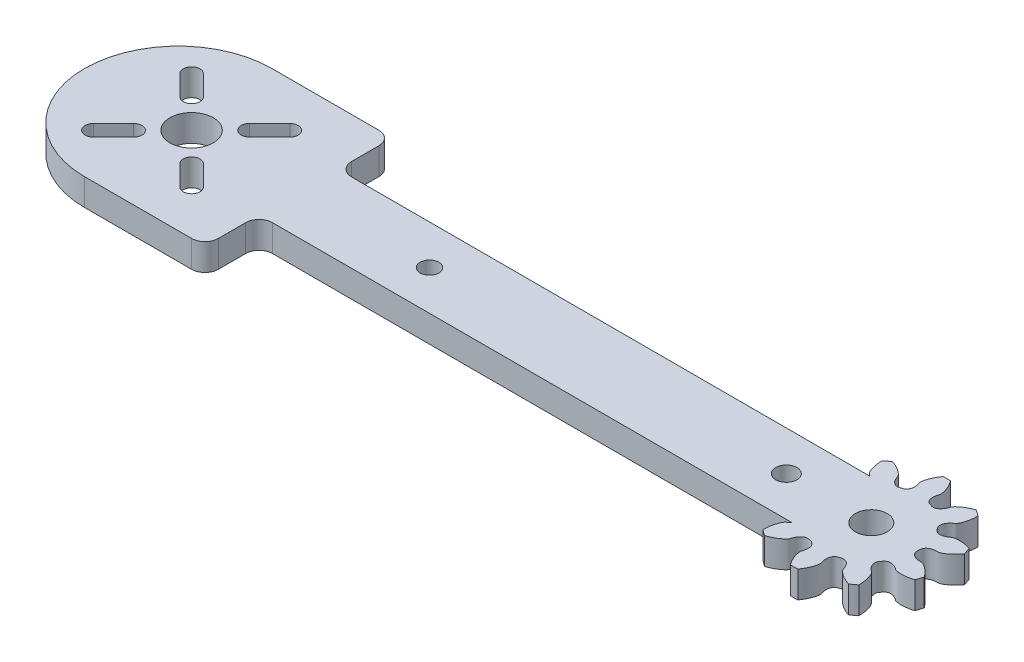
from build123d import *

# Parameters (mm, degrees)
SKETCH1_R           = 3.25
SKETCH1_R_2         = 2.38125
SKETCH1_R_3         = 1.397
BOSS_EXTRUDE1_DEPTH = 4
SKETCH2_R           = 1.5875
CUT_EXTRUDE1_DEPTH  = 10
SKETCH3_R           = 4.073496064
BOSS_EXTRUDE2_DEPTH = 4


with BuildPart() as part:
    # Sketch1 → Boss-Extrude1 (new body)
    with BuildSketch(Plane(origin=(0, 0, 0), x_dir=(1, 0, 0), z_dir=(0, 1, 0))):
        with BuildLine():
            Line((-50.8, 14), (-36.8, 14))
            ThreePointArc((-36.8, 14), (-35.385786438, 13.414213562), (-34.8, 12))
            Line((-34.8, 12), (-34.8, 7.914556152))
            ThreePointArc((-34.8, 7.914556152), (-34.214213562, 6.500342589), (-32.8, 5.914556152))
            Line((-32.8, 5.914556152), (50.8, 5.914556152))
            ThreePointArc((50.8, 5.914556152), (56.714556152, 0), (50.8, -5.914556152))
            Line((50.8, -5.914556152), (-32.8, -5.914556152))
            ThreePointArc((-32.8, -5.914556152), (-34.214213562, -6.500342589), (-34.8, -7.914556152))
            Line((-34.8, -7.914556152), (-34.8, -12))
            ThreePointArc((-34.8, -12), (-35.385786438, -13.414213562), (-36.8, -14))
            Line((-36.8, -14), (-50.8, -14))
            Line((-50.8, -14), (-52.8, -14))
            ThreePointArc((-52.8, -14), (-66.8, 0), (-52.8, 14))
            Line((-52.8, 14), (-50.8, 14))
        make_face()
        with Locations(Location((-50.8, 0, 0), (0, 0, 270))):
            Circle(SKETCH1_R, mode=Mode.SUBTRACT)
        with Locations(Location((50.8, 0, 0), (0, 0, 270))):
            Circle(SKETCH1_R_2, mode=Mode.SUBTRACT)
        with Locations(Location((-15.24, 0, 0), (0, 0, 270))):
            Circle(SKETCH1_R_3, mode=Mode.SUBTRACT)
        with BuildLine():
            Line((-57.252349378, 8.220116331), (-54.247145558, 5.214912511))
            ThreePointArc((-54.247145558, 5.214912511), (-54.247145558, 3.447145558), (-56.014912511, 3.447145558))
            Line((-56.014912511, 3.447145558), (-59.020116331, 6.452349378))
            ThreePointArc((-59.020116331, 6.452349378), (-59.020116331, 8.220116331), (-57.252349378, 8.220116331))
        make_face(mode=Mode.SUBTRACT)
        with BuildLine():
            Line((-42.579883669, 6.452349378), (-45.585087489, 3.447145558))
            ThreePointArc((-45.585087489, 3.447145558), (-47.352854442, 3.447145558), (-47.352854442, 5.214912511))
            Line((-47.352854442, 5.214912511), (-44.347650622, 8.220116331))
            ThreePointArc((-44.347650622, 8.220116331), (-42.579883669, 8.220116331), (-42.579883669, 6.452349378))
        make_face(mode=Mode.SUBTRACT)
        with BuildLine():
            Line((-44.347650622, -8.220116331), (-47.352854442, -5.214912511))
            ThreePointArc((-47.352854442, -5.214912511), (-47.352854442, -3.447145558), (-45.585087489, -3.447145558))
            Line((-45.585087489, -3.447145558), (-42.579883669, -6.452349378))
            ThreePointArc((-42.579883669, -6.452349378), (-42.579883669, -8.220116331), (-44.347650622, -8.220116331))
        make_face(mode=Mode.SUBTRACT)
        with BuildLine():
            Line((-59.020116331, -6.452349378), (-56.014912511, -3.447145558))
            ThreePointArc((-56.014912511, -3.447145558), (-54.247145558, -3.447145558), (-54.247145558, -5.214912511))
            Line((-54.247145558, -5.214912511), (-57.252349378, -8.220116331))
            ThreePointArc((-57.252349378, -8.220116331), (-59.020116331, -8.220116331), (-59.020116331, -6.452349378))
        make_face(mode=Mode.SUBTRACT)
    extrude(amount=BOSS_EXTRUDE1_DEPTH)

    # Sketch2 → Cut-Extrude1 (cut)
    with BuildSketch(Plane.XZ):
        with Locations(Location((38.1, 0, 0), (0, 0, 270))):
            Circle(SKETCH2_R)
    extrude(amount=-CUT_EXTRUDE1_DEPTH, mode=Mode.SUBTRACT)

    # Sketch3 → Boss-Extrude2 (add)
    with BuildSketch(Plane.XZ):
        with BuildLine():
            ThreePointArc((40.068598751, 4.133432129), (39.882647493, 3.605484733), (39.722765528, 3.069066911))
            add(Edge.make_bspline(
                [(39.722765528, 3.069066911), (39.809182967, 2.951634685), (39.952249972, 2.769228405), (40.158056435, 2.533738008), (40.325254018, 2.357387729), (40.488900389, 2.198223732), (40.6478942, 2.055651331), (40.801177141, 1.929015404), (40.947736968, 1.81760209), (41.086610747, 1.720645895), (41.216886482, 1.637317611), (41.337709478, 1.566775841), (41.448272804, 1.508014381), (41.547857445, 1.460356241), (41.635717662, 1.42194253), (41.728626895, 1.388001471), (41.848319719, 1.338065212), (41.966297751, 1.36311056), (42.057264692, 1.361140027), (42.105090723, 1.360437185), (42.152350457, 1.35867433), (42.199081225, 1.356226565), (42.29005034, 1.349871492), (42.408565167, 1.336535688), (42.552522967, 1.310710882), (42.676508835, 1.280779699), (42.795551967, 1.243895566), (42.909631527, 1.199785197), (43.018680002, 1.148016382), (43.110978775, 1.094644363), (43.187938568, 1.042176976), (43.251233813, 0.992889841), (43.311581446, 0.938972225), (43.368591345, 0.880099745), (43.421732251, 0.815974745), (43.470311441, 0.74637776), (43.513470144, 0.671236598), (43.550206445, 0.590708012), (43.579437165, 0.505258208), (43.596599863, 0.430906413), (43.605653125, 0.369875838), (43.610043077, 0.323392341), (43.611600505, 0.281813138), (43.611583378, 0.198459401), (43.607687576, 0.073420488), (43.611583378, -0.051618426), (43.611600505, -0.134972163), (43.610043077, -0.176551366), (43.605653125, -0.223034863), (43.596599863, -0.284065438), (43.579436317, -0.358417073), (43.550206682, -0.443867), (43.513470229, -0.524395611), (43.470311544, -0.599536804), (43.42173233, -0.669133808), (43.368591406, -0.733258818), (43.311581485, -0.792131303), (43.251233855, -0.846048909), (43.17746321, -0.903493053), (43.088504479, -0.962111014), (42.982897208, -1.019316936), (42.872159068, -1.068473874), (42.756420765, -1.110135864), (42.635728848, -1.144678819), (42.510097104, -1.17233085), (42.37953633, -1.193203414), (42.275273033, -1.204062855), (42.199081225, -1.20938559), (42.152350457, -1.211833355), (42.105090723, -1.21359621), (42.057264692, -1.214299052), (41.966297751, -1.216269585), (41.848319719, -1.191224237), (41.728626895, -1.241160496), (41.635717662, -1.275101555), (41.547857445, -1.313515265), (41.448272804, -1.361173405), (41.337709478, -1.419934865), (41.216886482, -1.490476636), (41.086610747, -1.57380492), (40.947736968, -1.670761115), (40.801177141, -1.782174428), (40.6478942, -1.908810356), (40.488900389, -2.051382757), (40.325254018, -2.210546754), (40.158056435, -2.386897033), (39.952249972, -2.62238743), (39.809182967, -2.80479371), (39.722765528, -2.922225936)],
                knots=[0.011285362, 0.011285362, 0.011285362, 0.011285362, 0.051699305, 0.075508195, 0.097956577, 0.119044452, 0.138771818, 0.157138677, 0.174145027, 0.18979087, 0.204076205, 0.217001032, 0.22856535, 0.238769161, 0.247612465, 0.25509526, 0.266315064, 0.282698066, 0.287163522, 0.29158073, 0.295950533, 0.300273826, 0.304551554, 0.321227804, 0.333312172, 0.345076541, 0.356567223, 0.367839534, 0.378959166, 0.390003215, 0.397367218, 0.404765512, 0.412228116, 0.41978525, 0.427465674, 0.435294369, 0.443289607, 0.451459663, 0.45979972, 0.468289823, 0.472580702, 0.476894834, 0.48122589, 0.484108929, 0.5, 0.515891071, 0.51877411, 0.523105166, 0.527419298, 0.531710177, 0.54020028, 0.548540337, 0.556710393, 0.564705631, 0.572534326, 0.58021475, 0.587771884, 0.595234488, 0.602632782, 0.613674977, 0.624734931, 0.635897467, 0.647235808, 0.658812047, 0.67067834, 0.682878315, 0.695448446, 0.699726174, 0.704049467, 0.70841927, 0.712836478, 0.717301934, 0.733684936, 0.74490474, 0.752387535, 0.761230839, 0.77143465, 0.782998968, 0.795923795, 0.81020913, 0.825854973, 0.842861323, 0.861228182, 0.880955548, 0.902043423, 0.924491805, 0.948300695, 0.988714638, 0.988714638, 0.988714638, 0.988714638], degree=3, weights=[1, 1, 1, 1, 1, 1, 1, 1, 1, 1, 1, 1, 1, 1, 1, 1, 1, 1, 1, 1, 1, 1, 1, 1, 1, 1, 1, 1, 1, 1, 1, 1, 1, 1, 1, 1, 1, 1, 1, 1, 1, 1, 1, 1, 1, 1, 1, 1, 1, 1, 1, 1, 1, 1, 1, 1, 1, 1, 1, 1, 1, 1, 1, 1, 1, 1, 1, 1, 1, 1, 1, 1, 1, 1, 1, 1, 1, 1, 1, 1, 1, 1, 1, 1, 1, 1, 1, 1, 1]))
            ThreePointArc((39.722765528, -2.922225936), (39.882647493, -3.458643758), (40.068598751, -3.986591153))
            add(Edge.make_bspline(
                [(40.068598751, -3.986591153), (40.207536858, -4.030800924), (40.430496218, -4.094278029), (40.735414927, -4.163823758), (40.974336706, -4.208217857), (41.200283652, -4.240795312), (41.412714301, -4.26268459), (41.611157536, -4.275037755), (41.795214029, -4.279027315), (41.964554698, -4.275838565), (42.118929118, -4.266678407), (42.258140387, -4.252729923), (42.382127117, -4.23528145), (42.490705535, -4.215303312), (42.584364956, -4.194737717), (42.679480159, -4.167585934), (42.805665485, -4.137631538), (42.886390431, -4.048023679), (42.961142482, -3.996148847), (43.000247674, -3.968606023), (43.039517783, -3.942253628), (43.078762529, -3.916766255), (43.156093506, -3.868437313), (43.259812604, -3.809564938), (43.391456351, -3.745841373), (43.509356134, -3.697179144), (43.627344, -3.657047237), (43.745563727, -3.625678992), (43.864214743, -3.603463758), (43.970257304, -3.592390771), (44.063358641, -3.589601947), (44.143535821, -3.592272065), (44.224050061, -3.600420884), (44.304776413, -3.614540143), (44.385460039, -3.635182917), (44.46566951, -3.662933929), (44.544752501, -3.698356357), (44.621806309, -3.741912296), (44.695680593, -3.793861253), (44.753268395, -3.843925138), (44.79646551, -3.887978537), (44.82733937, -3.923004127), (44.853038998, -3.955726976), (44.90201924, -4.023171632), (44.972363499, -4.126620133), (45.049011298, -4.225488844), (45.098019251, -4.292913367), (45.121198907, -4.327467082), (45.144969676, -4.36765337), (45.173518305, -4.422349516), (45.203335499, -4.492589731), (45.229914435, -4.578900923), (45.247527549, -4.665643083), (45.256778326, -4.751801624), (45.258385008, -4.836660928), (45.253084833, -4.919774603), (45.241567217, -5.000913035), (45.224436932, -5.080004741), (45.198520047, -5.169839327), (45.161005694, -5.269550884), (45.109192415, -5.377905843), (45.048497101, -5.482764887), (44.979351151, -5.584499412), (44.902013178, -5.683386179), (44.816628418, -5.779601629), (44.723271119, -5.873229585), (44.645303359, -5.943299485), (44.586791516, -5.992390089), (44.550424291, -6.021838029), (44.513226543, -6.051042784), (44.474947592, -6.079722831), (44.402512041, -6.134786052), (44.292344522, -6.183869687), (44.224862789, -6.294622646), (44.169647695, -6.376692217), (44.121146298, -6.459412501), (44.068593384, -6.556503129), (44.013684893, -6.669029641), (43.957400449, -6.797117108), (43.900984302, -6.941105261), (43.845622476, -7.10117243), (43.792540188, -7.277453399), (43.742966414, -7.470001468), (43.698139674, -7.678799181), (43.659301228, -7.903754483), (43.627691636, -8.144701129), (43.599608491, -8.456186866), (43.591080575, -8.687849323), (43.590192329, -8.833648885)],
                knots=[0.011285362, 0.011285362, 0.011285362, 0.011285362, 0.051699305, 0.075508195, 0.097956577, 0.119044452, 0.138771818, 0.157138677, 0.174145027, 0.18979087, 0.204076205, 0.217001032, 0.22856535, 0.238769161, 0.247612465, 0.25509526, 0.266315064, 0.282698066, 0.287163522, 0.29158073, 0.295950533, 0.300273826, 0.304551554, 0.321227804, 0.333312172, 0.345076541, 0.356567223, 0.367839534, 0.378959166, 0.390003215, 0.397367218, 0.404765512, 0.412228116, 0.41978525, 0.427465674, 0.435294369, 0.443289607, 0.451459663, 0.45979972, 0.468289823, 0.472580702, 0.476894834, 0.48122589, 0.484108929, 0.5, 0.515891071, 0.51877411, 0.523105166, 0.527419298, 0.531710177, 0.54020028, 0.548540337, 0.556710393, 0.564705631, 0.572534326, 0.58021475, 0.587771884, 0.595234488, 0.602632782, 0.613674977, 0.624734931, 0.635897467, 0.647235808, 0.658812047, 0.67067834, 0.682878315, 0.695448446, 0.699726174, 0.704049467, 0.70841927, 0.712836478, 0.717301934, 0.733684936, 0.74490474, 0.752387535, 0.761230839, 0.77143465, 0.782998968, 0.795923795, 0.81020913, 0.825854973, 0.842861323, 0.861228182, 0.880955548, 0.902043423, 0.924491805, 0.948300695, 0.988714638, 0.988714638, 0.988714638, 0.988714638], degree=3, weights=[1, 1, 1, 1, 1, 1, 1, 1, 1, 1, 1, 1, 1, 1, 1, 1, 1, 1, 1, 1, 1, 1, 1, 1, 1, 1, 1, 1, 1, 1, 1, 1, 1, 1, 1, 1, 1, 1, 1, 1, 1, 1, 1, 1, 1, 1, 1, 1, 1, 1, 1, 1, 1, 1, 1, 1, 1, 1, 1, 1, 1, 1, 1, 1, 1, 1, 1, 1, 1, 1, 1, 1, 1, 1, 1, 1, 1, 1, 1, 1, 1, 1, 1, 1, 1, 1, 1, 1, 1]))
            ThreePointArc((43.590192329, -8.833648885), (44.03483804, -9.173643758), (44.495595461, -9.491462766))
            add(Edge.make_bspline(
                [(44.495595461, -9.491462766), (44.633984602, -9.445563451), (44.85167342, -9.365865284), (45.139235791, -9.24290224), (45.358621767, -9.138383123), (45.560565233, -9.031930555), (45.745291434, -8.92477575), (45.913096392, -8.818127664), (46.064346227, -8.713169593), (46.199471406, -8.611053892), (46.318978729, -8.512904162), (46.423404299, -8.41979327), (46.513455715, -8.332799588), (46.589554646, -8.252816142), (46.653238555, -8.181126599), (46.714228953, -8.103253032), (46.798708274, -8.004849544), (46.81134595, -7.884906329), (46.841330368, -7.799000556), (46.856777867, -7.753732487), (46.873058503, -7.709330561), (46.889827068, -7.665643361), (46.923982103, -7.581090417), (46.973288303, -7.472497109), (47.042334559, -7.343565409), (47.109114547, -7.234897086), (47.180979792, -7.133078163), (47.258183769, -7.038212908), (47.34111667, -6.950499088), (47.420398365, -6.8792106), (47.4940797, -6.822230802), (47.560513857, -6.777264009), (47.630441001, -6.736531459), (47.704049084, -6.70050442), (47.781457027, -6.66978013), (47.862659488, -6.645085226), (47.947459752, -6.627258756), (48.03539913, -6.617205159), (48.125699513, -6.615810534), (48.201715837, -6.622463806), (48.262556975, -6.632713128), (48.308121977, -6.642902226), (48.348147421, -6.654269704), (48.427416243, -6.680043713), (48.545131448, -6.72238799), (48.66525439, -6.757322012), (48.744533797, -6.783063445), (48.783596697, -6.797393327), (48.82644856, -6.81593261), (48.881694475, -6.843402259), (48.947103254, -6.882701679), (49.01933851, -6.936906194), (49.084573582, -6.996729347), (49.142700336, -7.0609956), (49.193879218, -7.128703836), (49.238444278, -7.199059575), (49.276818305, -7.27147183), (49.309448551, -7.345527294), (49.341284796, -7.433438564), (49.369544029, -7.536157291), (49.391315653, -7.654273376), (49.403846712, -7.774781935), (49.407704517, -7.897729865), (49.403260966, -8.023189059), (49.390737266, -8.151216896), (49.370242756, -8.281837547), (49.348351568, -8.384353587), (49.329869226, -8.458461118), (49.317756588, -8.50366112), (49.304829101, -8.549152551), (49.290718488, -8.594854999), (49.264482245, -8.681978629), (49.204205487, -8.786442967), (49.214710574, -8.915708761), (49.218279908, -9.014559056), (49.227663217, -9.109989577), (49.242215455, -9.219427374), (49.263934978, -9.342737635), (49.293687829, -9.479445739), (49.332680321, -9.629095181), (49.381976784, -9.791133106), (49.442647665, -9.964948392), (49.515718555, -10.149861785), (49.602181177, -10.34513118), (49.702985623, -10.549952508), (49.819037811, -10.763462091), (49.979404792, -11.031966204), (50.108673338, -11.224397652), (50.193653565, -11.342874074)],
                knots=[0.011285362, 0.011285362, 0.011285362, 0.011285362, 0.051699305, 0.075508195, 0.097956577, 0.119044452, 0.138771818, 0.157138677, 0.174145027, 0.18979087, 0.204076205, 0.217001032, 0.22856535, 0.238769161, 0.247612465, 0.25509526, 0.266315064, 0.282698066, 0.287163522, 0.29158073, 0.295950533, 0.300273826, 0.304551554, 0.321227804, 0.333312172, 0.345076541, 0.356567223, 0.367839534, 0.378959166, 0.390003215, 0.397367218, 0.404765512, 0.412228116, 0.41978525, 0.427465674, 0.435294369, 0.443289607, 0.451459663, 0.45979972, 0.468289823, 0.472580702, 0.476894834, 0.48122589, 0.484108929, 0.5, 0.515891071, 0.51877411, 0.523105166, 0.527419298, 0.531710177, 0.54020028, 0.548540337, 0.556710393, 0.564705631, 0.572534326, 0.58021475, 0.587771884, 0.595234488, 0.602632782, 0.613674977, 0.624734931, 0.635897467, 0.647235808, 0.658812047, 0.67067834, 0.682878315, 0.695448446, 0.699726174, 0.704049467, 0.70841927, 0.712836478, 0.717301934, 0.733684936, 0.74490474, 0.752387535, 0.761230839, 0.77143465, 0.782998968, 0.795923795, 0.81020913, 0.825854973, 0.842861323, 0.861228182, 0.880955548, 0.902043423, 0.924491805, 0.948300695, 0.988714638, 0.988714638, 0.988714638, 0.988714638], degree=3, weights=[1, 1, 1, 1, 1, 1, 1, 1, 1, 1, 1, 1, 1, 1, 1, 1, 1, 1, 1, 1, 1, 1, 1, 1, 1, 1, 1, 1, 1, 1, 1, 1, 1, 1, 1, 1, 1, 1, 1, 1, 1, 1, 1, 1, 1, 1, 1, 1, 1, 1, 1, 1, 1, 1, 1, 1, 1, 1, 1, 1, 1, 1, 1, 1, 1, 1, 1, 1, 1, 1, 1, 1, 1, 1, 1, 1, 1, 1, 1, 1, 1, 1, 1, 1, 1, 1, 1, 1, 1]))
            ThreePointArc((50.193653565, -11.342874074), (50.753223474, -11.356579512), (51.312793383, -11.342874074))
            add(Edge.make_bspline(
                [(51.312793383, -11.342874074), (51.39777361, -11.224397652), (51.527042156, -11.031966204), (51.687409137, -10.763462091), (51.803461325, -10.549952508), (51.904265771, -10.34513118), (51.990728393, -10.149861785), (52.063799283, -9.964948392), (52.124470164, -9.791133106), (52.173766627, -9.629095181), (52.212759119, -9.479445739), (52.24251197, -9.342737635), (52.264231493, -9.219427374), (52.278783731, -9.109989577), (52.28816704, -9.014559056), (52.291736374, -8.915708761), (52.302241461, -8.786442967), (52.241964703, -8.681978629), (52.21572846, -8.594854999), (52.201617847, -8.549152551), (52.18869036, -8.50366112), (52.176577722, -8.458461118), (52.154510753, -8.369980523), (52.130570761, -8.253145235), (52.110646204, -8.108252927), (52.100798711, -7.981086115), (52.099091255, -7.856471545), (52.105790186, -7.734344582), (52.121327423, -7.614635875), (52.14356534, -7.510361665), (52.169682906, -7.420955239), (52.19699845, -7.345527321), (52.229628707, -7.271471851), (52.268002734, -7.199059619), (52.312567791, -7.128703899), (52.363746662, -7.060995693), (52.42187338, -6.996729431), (52.487108476, -6.936906431), (52.559343279, -6.882700922), (52.624752473, -6.843402259), (52.679998388, -6.81593261), (52.722850251, -6.797393327), (52.761913151, -6.783063445), (52.841192558, -6.757322012), (52.9613155, -6.72238799), (53.079030704, -6.680043713), (53.158299527, -6.654269704), (53.198324971, -6.642902226), (53.243889973, -6.632713128), (53.304731111, -6.622463806), (53.380747545, -6.615811389), (53.471047709, -6.617204944), (53.558987158, -6.627258679), (53.643787446, -6.645085121), (53.724989933, -6.669780043), (53.802397891, -6.700504346), (53.876005986, -6.736531405), (53.945933119, -6.777263955), (54.02336213, -6.829672792), (54.106600883, -6.896163626), (54.193641389, -6.978924507), (54.274612383, -7.069052408), (54.350000392, -7.166251812), (54.420148548, -7.270362285), (54.485269537, -7.381300227), (54.545466022, -7.499020925), (54.588013095, -7.594825461), (54.61661988, -7.665643361), (54.633388445, -7.709330561), (54.649669081, -7.753732487), (54.66511658, -7.799000556), (54.695100998, -7.884906329), (54.707738674, -8.004849544), (54.792217995, -8.103253032), (54.853208392, -8.181126599), (54.916892302, -8.252816142), (54.992991233, -8.332799588), (55.083042649, -8.41979327), (55.187468219, -8.512904162), (55.306975542, -8.611053892), (55.442100721, -8.713169593), (55.593350556, -8.818127664), (55.761155514, -8.92477575), (55.945881715, -9.031930555), (56.147825181, -9.138383123), (56.367211157, -9.24290224), (56.654773528, -9.365865284), (56.872462346, -9.445563451), (57.010851487, -9.491462766)],
                knots=[0.011285362, 0.011285362, 0.011285362, 0.011285362, 0.051699305, 0.075508195, 0.097956577, 0.119044452, 0.138771818, 0.157138677, 0.174145027, 0.18979087, 0.204076205, 0.217001032, 0.22856535, 0.238769161, 0.247612465, 0.25509526, 0.266315064, 0.282698066, 0.287163522, 0.29158073, 0.295950533, 0.300273826, 0.304551554, 0.321227804, 0.333312172, 0.345076541, 0.356567223, 0.367839534, 0.378959166, 0.390003215, 0.397367218, 0.404765512, 0.412228116, 0.41978525, 0.427465674, 0.435294369, 0.443289607, 0.451459663, 0.45979972, 0.468289823, 0.472580702, 0.476894834, 0.48122589, 0.484108929, 0.5, 0.515891071, 0.51877411, 0.523105166, 0.527419298, 0.531710177, 0.54020028, 0.548540337, 0.556710393, 0.564705631, 0.572534326, 0.58021475, 0.587771884, 0.595234488, 0.602632782, 0.613674977, 0.624734931, 0.635897467, 0.647235808, 0.658812047, 0.67067834, 0.682878315, 0.695448446, 0.699726174, 0.704049467, 0.70841927, 0.712836478, 0.717301934, 0.733684936, 0.74490474, 0.752387535, 0.761230839, 0.77143465, 0.782998968, 0.795923795, 0.81020913, 0.825854973, 0.842861323, 0.861228182, 0.880955548, 0.902043423, 0.924491805, 0.948300695, 0.988714638, 0.988714638, 0.988714638, 0.988714638], degree=3, weights=[1, 1, 1, 1, 1, 1, 1, 1, 1, 1, 1, 1, 1, 1, 1, 1, 1, 1, 1, 1, 1, 1, 1, 1, 1, 1, 1, 1, 1, 1, 1, 1, 1, 1, 1, 1, 1, 1, 1, 1, 1, 1, 1, 1, 1, 1, 1, 1, 1, 1, 1, 1, 1, 1, 1, 1, 1, 1, 1, 1, 1, 1, 1, 1, 1, 1, 1, 1, 1, 1, 1, 1, 1, 1, 1, 1, 1, 1, 1, 1, 1, 1, 1, 1, 1, 1, 1, 1, 1]))
            ThreePointArc((57.010851487, -9.491462766), (57.471608908, -9.173643758), (57.916254619, -8.833648885))
            add(Edge.make_bspline(
                [(57.916254619, -8.833648885), (57.915366373, -8.687849323), (57.906838456, -8.456186866), (57.878755312, -8.144701129), (57.84714572, -7.903754483), (57.808307274, -7.678799181), (57.763480534, -7.470001468), (57.71390676, -7.277453399), (57.660824472, -7.10117243), (57.605462646, -6.941105261), (57.549046499, -6.797117108), (57.492762055, -6.669029641), (57.437853564, -6.556503129), (57.38530065, -6.459412501), (57.336799253, -6.376692217), (57.281584159, -6.294622646), (57.214102426, -6.183869687), (57.103934907, -6.134786052), (57.031499356, -6.079722831), (56.993220405, -6.051042784), (56.956022657, -6.021838029), (56.919655432, -5.992390089), (56.84979529, -5.933778424), (56.76175337, -5.853328264), (56.660468503, -5.747819285), (56.577754937, -5.650727384), (56.50312697, -5.550915697), (56.436762091, -5.448175376), (56.378968967, -5.342196439), (56.335668978, -5.244765711), (56.304246753, -5.157082872), (56.282010075, -5.080004731), (56.264879794, -5.000913014), (56.253362192, -4.9197746), (56.248062026, -4.836660944), (56.249668717, -4.751801669), (56.258919459, -4.665643143), (56.276532683, -4.578901093), (56.303110668, -4.492589363), (56.332928643, -4.422349516), (56.361477272, -4.36765337), (56.385248041, -4.327467082), (56.408427697, -4.292913367), (56.45743565, -4.225488844), (56.534083449, -4.126620133), (56.604427708, -4.023171632), (56.65340795, -3.955726976), (56.679107578, -3.923004127), (56.709981438, -3.887978537), (56.753178553, -3.843925138), (56.810766947, -3.793861881), (56.884640426, -3.741912186), (56.961694371, -3.698356317), (57.040777365, -3.662933853), (57.120986867, -3.63518284), (57.201670513, -3.614540068), (57.282396887, -3.600420818), (57.362911118, -3.592272006), (57.456357645, -3.589160014), (57.562781543, -3.594025718), (57.681844417, -3.609819551), (57.800327178, -3.635140998), (57.918449735, -3.669465008), (58.036395386, -3.712460099), (58.154287059, -3.763933622), (58.272181528, -3.823789061), (58.362915327, -3.876288017), (58.427684419, -3.916766255), (58.466929165, -3.942253628), (58.506199274, -3.968606023), (58.545304465, -3.996148847), (58.620056517, -4.048023679), (58.700781463, -4.137631538), (58.826966789, -4.167585934), (58.922081992, -4.194737717), (59.015741413, -4.215303312), (59.124319831, -4.23528145), (59.24830656, -4.252729923), (59.38751783, -4.266678407), (59.54189225, -4.275838565), (59.711232919, -4.279027315), (59.895289412, -4.275037755), (60.093732647, -4.26268459), (60.306163296, -4.240795312), (60.532110242, -4.208217857), (60.771032021, -4.163823758), (61.07595073, -4.094278029), (61.29891009, -4.030800924), (61.437848197, -3.986591153)],
                knots=[0.011285362, 0.011285362, 0.011285362, 0.011285362, 0.051699305, 0.075508195, 0.097956577, 0.119044452, 0.138771818, 0.157138677, 0.174145027, 0.18979087, 0.204076205, 0.217001032, 0.22856535, 0.238769161, 0.247612465, 0.25509526, 0.266315064, 0.282698066, 0.287163522, 0.29158073, 0.295950533, 0.300273826, 0.304551554, 0.321227804, 0.333312172, 0.345076541, 0.356567223, 0.367839534, 0.378959166, 0.390003215, 0.397367218, 0.404765512, 0.412228116, 0.41978525, 0.427465674, 0.435294369, 0.443289607, 0.451459663, 0.45979972, 0.468289823, 0.472580702, 0.476894834, 0.48122589, 0.484108929, 0.5, 0.515891071, 0.51877411, 0.523105166, 0.527419298, 0.531710177, 0.54020028, 0.548540337, 0.556710393, 0.564705631, 0.572534326, 0.58021475, 0.587771884, 0.595234488, 0.602632782, 0.613674977, 0.624734931, 0.635897467, 0.647235808, 0.658812047, 0.67067834, 0.682878315, 0.695448446, 0.699726174, 0.704049467, 0.70841927, 0.712836478, 0.717301934, 0.733684936, 0.74490474, 0.752387535, 0.761230839, 0.77143465, 0.782998968, 0.795923795, 0.81020913, 0.825854973, 0.842861323, 0.861228182, 0.880955548, 0.902043423, 0.924491805, 0.948300695, 0.988714638, 0.988714638, 0.988714638, 0.988714638], degree=3, weights=[1, 1, 1, 1, 1, 1, 1, 1, 1, 1, 1, 1, 1, 1, 1, 1, 1, 1, 1, 1, 1, 1, 1, 1, 1, 1, 1, 1, 1, 1, 1, 1, 1, 1, 1, 1, 1, 1, 1, 1, 1, 1, 1, 1, 1, 1, 1, 1, 1, 1, 1, 1, 1, 1, 1, 1, 1, 1, 1, 1, 1, 1, 1, 1, 1, 1, 1, 1, 1, 1, 1, 1, 1, 1, 1, 1, 1, 1, 1, 1, 1, 1, 1, 1, 1, 1, 1, 1, 1]))
            ThreePointArc((61.437848197, -3.986591153), (61.623799455, -3.458643758), (61.78368142, -2.922225936))
            add(Edge.make_bspline(
                [(61.78368142, -2.922225936), (61.697263981, -2.80479371), (61.554196976, -2.62238743), (61.348390512, -2.386897033), (61.18119293, -2.210546754), (61.017546559, -2.051382757), (60.858552748, -1.908810356), (60.705269807, -1.782174428), (60.55870998, -1.670761115), (60.419836201, -1.57380492), (60.289560466, -1.490476636), (60.16873747, -1.419934865), (60.058174144, -1.361173405), (59.958589503, -1.313515265), (59.870729286, -1.275101555), (59.777820053, -1.241160496), (59.658127229, -1.191224237), (59.540149197, -1.216269585), (59.449182256, -1.214299052), (59.401356225, -1.21359621), (59.354096491, -1.211833355), (59.307365723, -1.20938559), (59.216396608, -1.203030517), (59.097881781, -1.189694713), (58.953923981, -1.163869907), (58.829938113, -1.133938723), (58.710894981, -1.097054591), (58.596815421, -1.052944222), (58.487766945, -1.001175407), (58.395468173, -0.947803388), (58.31850838, -0.895336001), (58.255213135, -0.846048866), (58.194865502, -0.79213125), (58.137855603, -0.73325877), (58.084714697, -0.66913377), (58.036135507, -0.599536785), (57.992976804, -0.524395623), (57.956240503, -0.443867037), (57.927009783, -0.358417233), (57.909847085, -0.284065438), (57.900793823, -0.223034863), (57.896403871, -0.176551366), (57.894846443, -0.134972163), (57.89486357, -0.051618426), (57.898759372, 0.073420488), (57.89486357, 0.198459401), (57.894846443, 0.281813138), (57.896403871, 0.323392341), (57.900793823, 0.369875838), (57.909847085, 0.430906413), (57.927010631, 0.505258048), (57.956240266, 0.590707975), (57.992976719, 0.671236586), (58.036135404, 0.746377779), (58.084714618, 0.815974783), (58.137855542, 0.880099794), (58.194865462, 0.938972279), (58.255213093, 0.992889884), (58.328983738, 1.050334028), (58.417942469, 1.108951989), (58.52354974, 1.166157911), (58.63428788, 1.215314849), (58.750026183, 1.256976839), (58.8707181, 1.291519794), (58.996349844, 1.319171825), (59.126910618, 1.340044389), (59.231173915, 1.35090383), (59.307365723, 1.356226565), (59.354096491, 1.35867433), (59.401356225, 1.360437185), (59.449182256, 1.361140027), (59.540149197, 1.36311056), (59.658127229, 1.338065212), (59.777820053, 1.388001471), (59.870729286, 1.42194253), (59.958589503, 1.460356241), (60.058174144, 1.508014381), (60.16873747, 1.566775841), (60.289560466, 1.637317611), (60.419836201, 1.720645895), (60.55870998, 1.81760209), (60.705269807, 1.929015404), (60.858552748, 2.055651331), (61.017546559, 2.198223732), (61.18119293, 2.357387729), (61.348390512, 2.533738008), (61.554196976, 2.769228405), (61.697263981, 2.951634685), (61.78368142, 3.069066911)],
                knots=[0.011285362, 0.011285362, 0.011285362, 0.011285362, 0.051699305, 0.075508195, 0.097956577, 0.119044452, 0.138771818, 0.157138677, 0.174145027, 0.18979087, 0.204076205, 0.217001032, 0.22856535, 0.238769161, 0.247612465, 0.25509526, 0.266315064, 0.282698066, 0.287163522, 0.29158073, 0.295950533, 0.300273826, 0.304551554, 0.321227804, 0.333312172, 0.345076541, 0.356567223, 0.367839534, 0.378959166, 0.390003215, 0.397367218, 0.404765512, 0.412228116, 0.41978525, 0.427465674, 0.435294369, 0.443289607, 0.451459663, 0.45979972, 0.468289823, 0.472580702, 0.476894834, 0.48122589, 0.484108929, 0.5, 0.515891071, 0.51877411, 0.523105166, 0.527419298, 0.531710177, 0.54020028, 0.548540337, 0.556710393, 0.564705631, 0.572534326, 0.58021475, 0.587771884, 0.595234488, 0.602632782, 0.613674977, 0.624734931, 0.635897467, 0.647235808, 0.658812047, 0.67067834, 0.682878315, 0.695448446, 0.699726174, 0.704049467, 0.70841927, 0.712836478, 0.717301934, 0.733684936, 0.74490474, 0.752387535, 0.761230839, 0.77143465, 0.782998968, 0.795923795, 0.81020913, 0.825854973, 0.842861323, 0.861228182, 0.880955548, 0.902043423, 0.924491805, 0.948300695, 0.988714638, 0.988714638, 0.988714638, 0.988714638], degree=3, weights=[1, 1, 1, 1, 1, 1, 1, 1, 1, 1, 1, 1, 1, 1, 1, 1, 1, 1, 1, 1, 1, 1, 1, 1, 1, 1, 1, 1, 1, 1, 1, 1, 1, 1, 1, 1, 1, 1, 1, 1, 1, 1, 1, 1, 1, 1, 1, 1, 1, 1, 1, 1, 1, 1, 1, 1, 1, 1, 1, 1, 1, 1, 1, 1, 1, 1, 1, 1, 1, 1, 1, 1, 1, 1, 1, 1, 1, 1, 1, 1, 1, 1, 1, 1, 1, 1, 1, 1, 1]))
            ThreePointArc((61.78368142, 3.069066911), (61.623799455, 3.605484733), (61.437848197, 4.133432129))
            add(Edge.make_bspline(
                [(61.437848197, 4.133432129), (61.29891009, 4.177641899), (61.07595073, 4.241119004), (60.771032021, 4.310664733), (60.532110242, 4.355058832), (60.306163296, 4.387636287), (60.093732647, 4.409525565), (59.895289412, 4.42187873), (59.711232919, 4.42586829), (59.54189225, 4.42267954), (59.38751783, 4.413519382), (59.24830656, 4.399570898), (59.124319831, 4.382122425), (59.015741413, 4.362144287), (58.922081992, 4.341578692), (58.826966789, 4.314426909), (58.700781463, 4.284472513), (58.620056517, 4.194864654), (58.545304465, 4.142989822), (58.506199274, 4.115446998), (58.466929165, 4.089094603), (58.427684419, 4.06360723), (58.350353442, 4.015278288), (58.246634343, 3.956405913), (58.114990597, 3.892682348), (57.997090814, 3.84402012), (57.879102948, 3.803888212), (57.760883221, 3.772519968), (57.642232205, 3.750304733), (57.536189644, 3.739231746), (57.443088307, 3.736442922), (57.362911127, 3.73911304), (57.282396887, 3.74726186), (57.201670535, 3.761381118), (57.120986909, 3.782023892), (57.040777438, 3.809774905), (56.961694447, 3.845197332), (56.884640639, 3.888753271), (56.810766355, 3.940702228), (56.753178553, 3.990766114), (56.709981438, 4.034819512), (56.679107578, 4.069845102), (56.65340795, 4.102567951), (56.604427708, 4.170012607), (56.534083449, 4.273461108), (56.45743565, 4.372329819), (56.408427697, 4.439754342), (56.385248041, 4.474308057), (56.361477272, 4.514494345), (56.332928643, 4.569190491), (56.303111448, 4.639430706), (56.276532513, 4.725741898), (56.258919398, 4.812484058), (56.249668622, 4.898642599), (56.24806194, 4.983501904), (56.253362114, 5.066615578), (56.264879731, 5.14775401), (56.282010016, 5.226845716), (56.307926901, 5.316680302), (56.345441254, 5.416391859), (56.397254533, 5.524746818), (56.457949847, 5.629605862), (56.527095797, 5.731340388), (56.604433769, 5.830227154), (56.68981853, 5.926442604), (56.783175829, 6.02007056), (56.861143589, 6.090140461), (56.919655432, 6.139231064), (56.956022657, 6.168679004), (56.993220405, 6.197883759), (57.031499356, 6.226563806), (57.103934907, 6.281627027), (57.214102426, 6.330710662), (57.281584159, 6.441463621), (57.336799253, 6.523533192), (57.38530065, 6.606253476), (57.437853564, 6.703344104), (57.492762055, 6.815870616), (57.549046499, 6.943958083), (57.605462646, 7.087946236), (57.660824472, 7.248013405), (57.71390676, 7.424294374), (57.763480534, 7.616842443), (57.808307274, 7.825640156), (57.84714572, 8.050595458), (57.878755312, 8.291542104), (57.906838456, 8.603027841), (57.915366373, 8.834690298), (57.916254619, 8.98048986)],
                knots=[0.011285362, 0.011285362, 0.011285362, 0.011285362, 0.051699305, 0.075508195, 0.097956577, 0.119044452, 0.138771818, 0.157138677, 0.174145027, 0.18979087, 0.204076205, 0.217001032, 0.22856535, 0.238769161, 0.247612465, 0.25509526, 0.266315064, 0.282698066, 0.287163522, 0.29158073, 0.295950533, 0.300273826, 0.304551554, 0.321227804, 0.333312172, 0.345076541, 0.356567223, 0.367839534, 0.378959166, 0.390003215, 0.397367218, 0.404765512, 0.412228116, 0.41978525, 0.427465674, 0.435294369, 0.443289607, 0.451459663, 0.45979972, 0.468289823, 0.472580702, 0.476894834, 0.48122589, 0.484108929, 0.5, 0.515891071, 0.51877411, 0.523105166, 0.527419298, 0.531710177, 0.54020028, 0.548540337, 0.556710393, 0.564705631, 0.572534326, 0.58021475, 0.587771884, 0.595234488, 0.602632782, 0.613674977, 0.624734931, 0.635897467, 0.647235808, 0.658812047, 0.67067834, 0.682878315, 0.695448446, 0.699726174, 0.704049467, 0.70841927, 0.712836478, 0.717301934, 0.733684936, 0.74490474, 0.752387535, 0.761230839, 0.77143465, 0.782998968, 0.795923795, 0.81020913, 0.825854973, 0.842861323, 0.861228182, 0.880955548, 0.902043423, 0.924491805, 0.948300695, 0.988714638, 0.988714638, 0.988714638, 0.988714638], degree=3, weights=[1, 1, 1, 1, 1, 1, 1, 1, 1, 1, 1, 1, 1, 1, 1, 1, 1, 1, 1, 1, 1, 1, 1, 1, 1, 1, 1, 1, 1, 1, 1, 1, 1, 1, 1, 1, 1, 1, 1, 1, 1, 1, 1, 1, 1, 1, 1, 1, 1, 1, 1, 1, 1, 1, 1, 1, 1, 1, 1, 1, 1, 1, 1, 1, 1, 1, 1, 1, 1, 1, 1, 1, 1, 1, 1, 1, 1, 1, 1, 1, 1, 1, 1, 1, 1, 1, 1, 1, 1]))
            ThreePointArc((57.916254619, 8.98048986), (57.471608908, 9.320484733), (57.010851487, 9.638303741))
            add(Edge.make_bspline(
                [(57.010851487, 9.638303741), (56.872462346, 9.592404426), (56.654773528, 9.512706259), (56.367211157, 9.389743215), (56.147825181, 9.285224098), (55.945881715, 9.17877153), (55.761155514, 9.071616725), (55.593350556, 8.964968639), (55.442100721, 8.860010568), (55.306975542, 8.757894868), (55.187468219, 8.659745137), (55.083042649, 8.566634245), (54.992991233, 8.479640563), (54.916892302, 8.399657117), (54.853208392, 8.327967574), (54.792217995, 8.250094007), (54.707738674, 8.151690519), (54.695100998, 8.031747304), (54.66511658, 7.945841531), (54.649669081, 7.900573462), (54.633388445, 7.856171536), (54.61661988, 7.812484336), (54.582464845, 7.727931392), (54.533158645, 7.619338084), (54.464112389, 7.490406384), (54.397332401, 7.381738061), (54.325467156, 7.279919138), (54.248263179, 7.185053883), (54.165330278, 7.097340063), (54.086048583, 7.026051575), (54.012367248, 6.969071777), (53.945933091, 6.924104984), (53.876005946, 6.883372434), (53.802397864, 6.847345395), (53.724989921, 6.816621105), (53.64378746, 6.791926201), (53.558987196, 6.774099731), (53.471047818, 6.764046134), (53.380747435, 6.762651509), (53.304731111, 6.769304782), (53.243889973, 6.779554103), (53.198324971, 6.789743201), (53.158299527, 6.801110679), (53.079030704, 6.826884688), (52.9613155, 6.869228965), (52.841192558, 6.904162987), (52.761913151, 6.92990442), (52.722850251, 6.944234302), (52.679998388, 6.962773585), (52.624752473, 6.990243234), (52.559343694, 7.029542654), (52.487108437, 7.083747169), (52.421873366, 7.143570322), (52.363746612, 7.207836575), (52.31256773, 7.275544811), (52.26800267, 7.34590055), (52.229628643, 7.418312806), (52.196998397, 7.492368269), (52.165162152, 7.580279539), (52.136902919, 7.682998266), (52.115131295, 7.801114351), (52.102600236, 7.92162291), (52.098742431, 8.04457084), (52.103185982, 8.170030034), (52.115709682, 8.298057871), (52.136204192, 8.428678522), (52.15809538, 8.531194562), (52.176577722, 8.605302093), (52.18869036, 8.650502095), (52.201617847, 8.695993526), (52.21572846, 8.741695974), (52.241964703, 8.828819604), (52.302241461, 8.933283942), (52.291736374, 9.062549736), (52.28816704, 9.161400031), (52.278783731, 9.256830552), (52.264231493, 9.366268349), (52.24251197, 9.48957861), (52.212759119, 9.626286714), (52.173766627, 9.775936156), (52.124470164, 9.937974081), (52.063799283, 10.111789367), (51.990728393, 10.29670276), (51.904265771, 10.491972155), (51.803461325, 10.696793483), (51.687409137, 10.910303066), (51.527042156, 11.178807179), (51.39777361, 11.371238627), (51.312793383, 11.489715049)],
                knots=[0.011285362, 0.011285362, 0.011285362, 0.011285362, 0.051699305, 0.075508195, 0.097956577, 0.119044452, 0.138771818, 0.157138677, 0.174145027, 0.18979087, 0.204076205, 0.217001032, 0.22856535, 0.238769161, 0.247612465, 0.25509526, 0.266315064, 0.282698066, 0.287163522, 0.29158073, 0.295950533, 0.300273826, 0.304551554, 0.321227804, 0.333312172, 0.345076541, 0.356567223, 0.367839534, 0.378959166, 0.390003215, 0.397367218, 0.404765512, 0.412228116, 0.41978525, 0.427465674, 0.435294369, 0.443289607, 0.451459663, 0.45979972, 0.468289823, 0.472580702, 0.476894834, 0.48122589, 0.484108929, 0.5, 0.515891071, 0.51877411, 0.523105166, 0.527419298, 0.531710177, 0.54020028, 0.548540337, 0.556710393, 0.564705631, 0.572534326, 0.58021475, 0.587771884, 0.595234488, 0.602632782, 0.613674977, 0.624734931, 0.635897467, 0.647235808, 0.658812047, 0.67067834, 0.682878315, 0.695448446, 0.699726174, 0.704049467, 0.70841927, 0.712836478, 0.717301934, 0.733684936, 0.74490474, 0.752387535, 0.761230839, 0.77143465, 0.782998968, 0.795923795, 0.81020913, 0.825854973, 0.842861323, 0.861228182, 0.880955548, 0.902043423, 0.924491805, 0.948300695, 0.988714638, 0.988714638, 0.988714638, 0.988714638], degree=3, weights=[1, 1, 1, 1, 1, 1, 1, 1, 1, 1, 1, 1, 1, 1, 1, 1, 1, 1, 1, 1, 1, 1, 1, 1, 1, 1, 1, 1, 1, 1, 1, 1, 1, 1, 1, 1, 1, 1, 1, 1, 1, 1, 1, 1, 1, 1, 1, 1, 1, 1, 1, 1, 1, 1, 1, 1, 1, 1, 1, 1, 1, 1, 1, 1, 1, 1, 1, 1, 1, 1, 1, 1, 1, 1, 1, 1, 1, 1, 1, 1, 1, 1, 1, 1, 1, 1, 1, 1, 1]))
            ThreePointArc((51.312793383, 11.489715049), (50.753223474, 11.503420488), (50.193653565, 11.489715049))
            add(Edge.make_bspline(
                [(50.193653565, 11.489715049), (50.108673338, 11.371238627), (49.979404792, 11.178807179), (49.819037811, 10.910303066), (49.702985623, 10.696793483), (49.602181177, 10.491972155), (49.515718555, 10.29670276), (49.442647665, 10.111789367), (49.381976784, 9.937974081), (49.332680321, 9.775936156), (49.293687829, 9.626286714), (49.263934978, 9.48957861), (49.242215455, 9.366268349), (49.227663217, 9.256830552), (49.218279908, 9.161400031), (49.214710574, 9.062549736), (49.204205487, 8.933283942), (49.264482245, 8.828819604), (49.290718488, 8.741695974), (49.304829101, 8.695993526), (49.317756588, 8.650502095), (49.329869226, 8.605302093), (49.351936195, 8.516821498), (49.375876187, 8.39998621), (49.395800744, 8.255093902), (49.405648237, 8.12792709), (49.407355693, 8.00331252), (49.400656762, 7.881185557), (49.385119525, 7.76147685), (49.362881608, 7.657202641), (49.336764042, 7.567796214), (49.309448498, 7.492368296), (49.276818241, 7.418312826), (49.238444214, 7.345900594), (49.193879157, 7.275544874), (49.142700286, 7.207836668), (49.084573568, 7.143570406), (49.019338472, 7.083747406), (48.947103668, 7.029541898), (48.881694475, 6.990243234), (48.82644856, 6.962773585), (48.783596697, 6.944234302), (48.744533797, 6.92990442), (48.66525439, 6.904162987), (48.545131448, 6.869228965), (48.427416243, 6.826884688), (48.348147421, 6.801110679), (48.308121977, 6.789743201), (48.262556975, 6.779554103), (48.201715837, 6.769304782), (48.125699403, 6.762652365), (48.035399239, 6.76404592), (47.94745979, 6.774099654), (47.862659502, 6.791926096), (47.781457015, 6.816621018), (47.704049057, 6.847345321), (47.630440962, 6.88337238), (47.560513829, 6.92410493), (47.483084818, 6.976513767), (47.399846065, 7.043004602), (47.312805559, 7.125765482), (47.231834565, 7.215893383), (47.156446556, 7.313092787), (47.0862984, 7.417203261), (47.021177411, 7.528141202), (46.960980926, 7.6458619), (46.918433853, 7.741666436), (46.889827068, 7.812484336), (46.873058503, 7.856171536), (46.856777867, 7.900573462), (46.841330368, 7.945841531), (46.81134595, 8.031747304), (46.798708274, 8.151690519), (46.714228953, 8.250094007), (46.653238555, 8.327967574), (46.589554646, 8.399657117), (46.513455715, 8.479640563), (46.423404299, 8.566634245), (46.318978729, 8.659745137), (46.199471406, 8.757894868), (46.064346227, 8.860010568), (45.913096392, 8.964968639), (45.745291434, 9.071616725), (45.560565233, 9.17877153), (45.358621767, 9.285224098), (45.139235791, 9.389743215), (44.85167342, 9.512706259), (44.633984602, 9.592404426), (44.495595461, 9.638303741)],
                knots=[0.011285362, 0.011285362, 0.011285362, 0.011285362, 0.051699305, 0.075508195, 0.097956577, 0.119044452, 0.138771818, 0.157138677, 0.174145027, 0.18979087, 0.204076205, 0.217001032, 0.22856535, 0.238769161, 0.247612465, 0.25509526, 0.266315064, 0.282698066, 0.287163522, 0.29158073, 0.295950533, 0.300273826, 0.304551554, 0.321227804, 0.333312172, 0.345076541, 0.356567223, 0.367839534, 0.378959166, 0.390003215, 0.397367218, 0.404765512, 0.412228116, 0.41978525, 0.427465674, 0.435294369, 0.443289607, 0.451459663, 0.45979972, 0.468289823, 0.472580702, 0.476894834, 0.48122589, 0.484108929, 0.5, 0.515891071, 0.51877411, 0.523105166, 0.527419298, 0.531710177, 0.54020028, 0.548540337, 0.556710393, 0.564705631, 0.572534326, 0.58021475, 0.587771884, 0.595234488, 0.602632782, 0.613674977, 0.624734931, 0.635897467, 0.647235808, 0.658812047, 0.67067834, 0.682878315, 0.695448446, 0.699726174, 0.704049467, 0.70841927, 0.712836478, 0.717301934, 0.733684936, 0.74490474, 0.752387535, 0.761230839, 0.77143465, 0.782998968, 0.795923795, 0.81020913, 0.825854973, 0.842861323, 0.861228182, 0.880955548, 0.902043423, 0.924491805, 0.948300695, 0.988714638, 0.988714638, 0.988714638, 0.988714638], degree=3, weights=[1, 1, 1, 1, 1, 1, 1, 1, 1, 1, 1, 1, 1, 1, 1, 1, 1, 1, 1, 1, 1, 1, 1, 1, 1, 1, 1, 1, 1, 1, 1, 1, 1, 1, 1, 1, 1, 1, 1, 1, 1, 1, 1, 1, 1, 1, 1, 1, 1, 1, 1, 1, 1, 1, 1, 1, 1, 1, 1, 1, 1, 1, 1, 1, 1, 1, 1, 1, 1, 1, 1, 1, 1, 1, 1, 1, 1, 1, 1, 1, 1, 1, 1, 1, 1, 1, 1, 1, 1]))
            ThreePointArc((44.495595461, 9.638303741), (44.03483804, 9.320484733), (43.590192329, 8.98048986))
            add(Edge.make_bspline(
                [(43.590192329, 8.98048986), (43.591080575, 8.834690298), (43.599608491, 8.603027841), (43.627691636, 8.291542104), (43.659301228, 8.050595458), (43.698139674, 7.825640156), (43.742966414, 7.616842443), (43.792540188, 7.424294374), (43.845622476, 7.248013405), (43.900984302, 7.087946236), (43.957400449, 6.943958083), (44.013684893, 6.815870616), (44.068593384, 6.703344104), (44.121146298, 6.606253476), (44.169647695, 6.523533192), (44.224862789, 6.441463621), (44.292344522, 6.330710662), (44.402512041, 6.281627027), (44.474947592, 6.226563806), (44.513226543, 6.197883759), (44.550424291, 6.168679004), (44.586791516, 6.139231064), (44.656651658, 6.080619399), (44.744693578, 6.000169239), (44.845978444, 5.89466026), (44.92869201, 5.797568359), (45.003319978, 5.697756672), (45.069684856, 5.595016351), (45.127477981, 5.489037414), (45.17077797, 5.391606686), (45.202200194, 5.303923847), (45.224436873, 5.226845706), (45.241567154, 5.147753989), (45.253084755, 5.066615575), (45.258384922, 4.983501919), (45.256778231, 4.898642644), (45.247527488, 4.812484118), (45.229914265, 4.725742068), (45.203336279, 4.639430338), (45.173518305, 4.569190491), (45.144969676, 4.514494345), (45.121198907, 4.474308057), (45.098019251, 4.439754342), (45.049011298, 4.372329819), (44.972363499, 4.273461108), (44.90201924, 4.170012607), (44.853038998, 4.102567951), (44.82733937, 4.069845102), (44.79646551, 4.034819512), (44.753268395, 3.990766114), (44.695680001, 3.940702856), (44.621806522, 3.888753161), (44.544752577, 3.845197292), (44.465669583, 3.809774828), (44.38546008, 3.782023815), (44.304776435, 3.761381043), (44.224050061, 3.747261793), (44.14353583, 3.739112981), (44.050089303, 3.736000989), (43.943665405, 3.740866693), (43.824602531, 3.756660526), (43.70611977, 3.781981973), (43.587997213, 3.816305983), (43.470051562, 3.859301074), (43.352159889, 3.910774598), (43.234265419, 3.970630036), (43.143531621, 4.023128992), (43.078762529, 4.06360723), (43.039517783, 4.089094603), (43.000247674, 4.115446998), (42.961142482, 4.142989822), (42.886390431, 4.194864654), (42.805665485, 4.284472513), (42.679480159, 4.314426909), (42.584364956, 4.341578692), (42.490705535, 4.362144287), (42.382127117, 4.382122425), (42.258140387, 4.399570898), (42.118929118, 4.413519382), (41.964554698, 4.42267954), (41.795214029, 4.42586829), (41.611157536, 4.42187873), (41.412714301, 4.409525565), (41.200283652, 4.387636287), (40.974336706, 4.355058832), (40.735414927, 4.310664733), (40.430496218, 4.241119004), (40.207536858, 4.177641899), (40.068598751, 4.133432129)],
                knots=[0.011285362, 0.011285362, 0.011285362, 0.011285362, 0.051699305, 0.075508195, 0.097956577, 0.119044452, 0.138771818, 0.157138677, 0.174145027, 0.18979087, 0.204076205, 0.217001032, 0.22856535, 0.238769161, 0.247612465, 0.25509526, 0.266315064, 0.282698066, 0.287163522, 0.29158073, 0.295950533, 0.300273826, 0.304551554, 0.321227804, 0.333312172, 0.345076541, 0.356567223, 0.367839534, 0.378959166, 0.390003215, 0.397367218, 0.404765512, 0.412228116, 0.41978525, 0.427465674, 0.435294369, 0.443289607, 0.451459663, 0.45979972, 0.468289823, 0.472580702, 0.476894834, 0.48122589, 0.484108929, 0.5, 0.515891071, 0.51877411, 0.523105166, 0.527419298, 0.531710177, 0.54020028, 0.548540337, 0.556710393, 0.564705631, 0.572534326, 0.58021475, 0.587771884, 0.595234488, 0.602632782, 0.613674977, 0.624734931, 0.635897467, 0.647235808, 0.658812047, 0.67067834, 0.682878315, 0.695448446, 0.699726174, 0.704049467, 0.70841927, 0.712836478, 0.717301934, 0.733684936, 0.74490474, 0.752387535, 0.761230839, 0.77143465, 0.782998968, 0.795923795, 0.81020913, 0.825854973, 0.842861323, 0.861228182, 0.880955548, 0.902043423, 0.924491805, 0.948300695, 0.988714638, 0.988714638, 0.988714638, 0.988714638], degree=3, weights=[1, 1, 1, 1, 1, 1, 1, 1, 1, 1, 1, 1, 1, 1, 1, 1, 1, 1, 1, 1, 1, 1, 1, 1, 1, 1, 1, 1, 1, 1, 1, 1, 1, 1, 1, 1, 1, 1, 1, 1, 1, 1, 1, 1, 1, 1, 1, 1, 1, 1, 1, 1, 1, 1, 1, 1, 1, 1, 1, 1, 1, 1, 1, 1, 1, 1, 1, 1, 1, 1, 1, 1, 1, 1, 1, 1, 1, 1, 1, 1, 1, 1, 1, 1, 1, 1, 1, 1, 1]))
        make_face()
        with Locations((50.753223474, 0.073420488)):
            Circle(SKETCH3_R, mode=Mode.SUBTRACT)
    extrude(amount=-BOSS_EXTRUDE2_DEPTH)


solid = part.part
